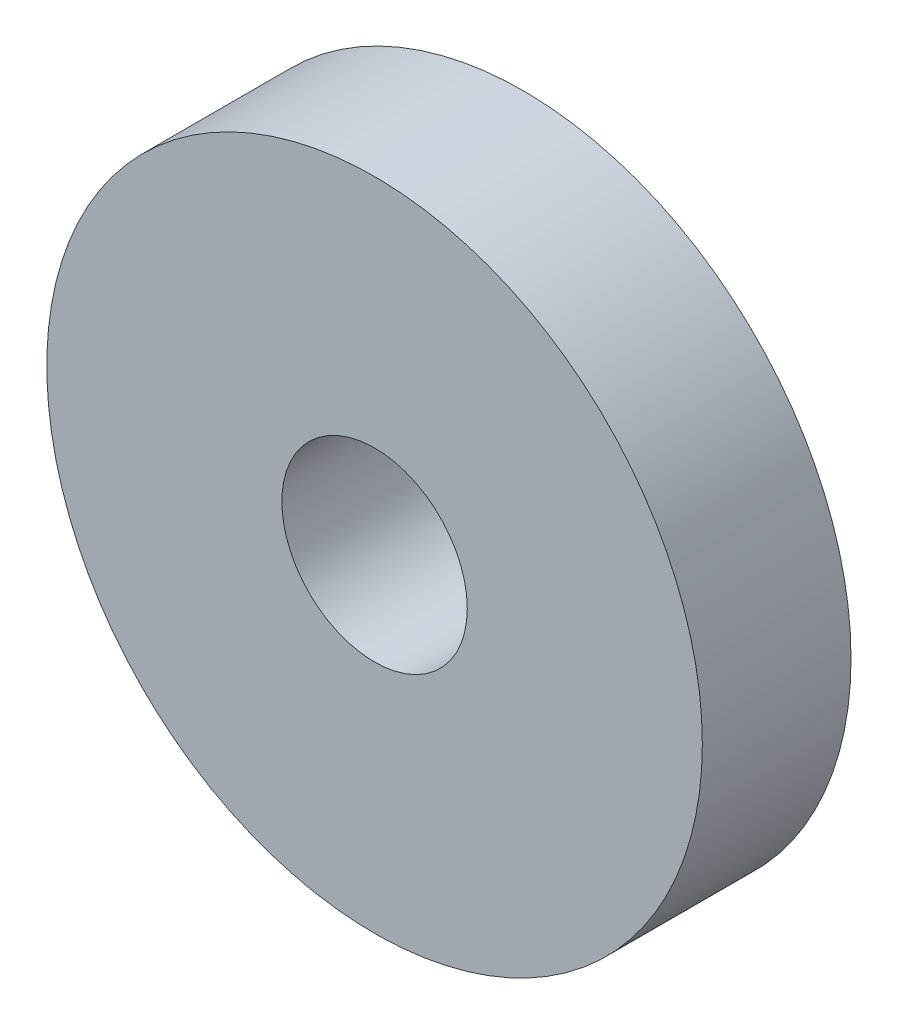
from build123d import *

# Parameters (mm, degrees)
ESQUISSE1_R        = 14
ESQUISSE1_R_2      = 3.96
BOSS_EXTRU_1_DEPTH = 6.35


with BuildPart() as part:
    # Esquisse1 → Boss.-Extru.1 (new body)
    with BuildSketch(Plane.XY):
        Circle(ESQUISSE1_R)
        Circle(ESQUISSE1_R_2, mode=Mode.SUBTRACT)
    extrude(amount=BOSS_EXTRU_1_DEPTH)


solid = part.part
